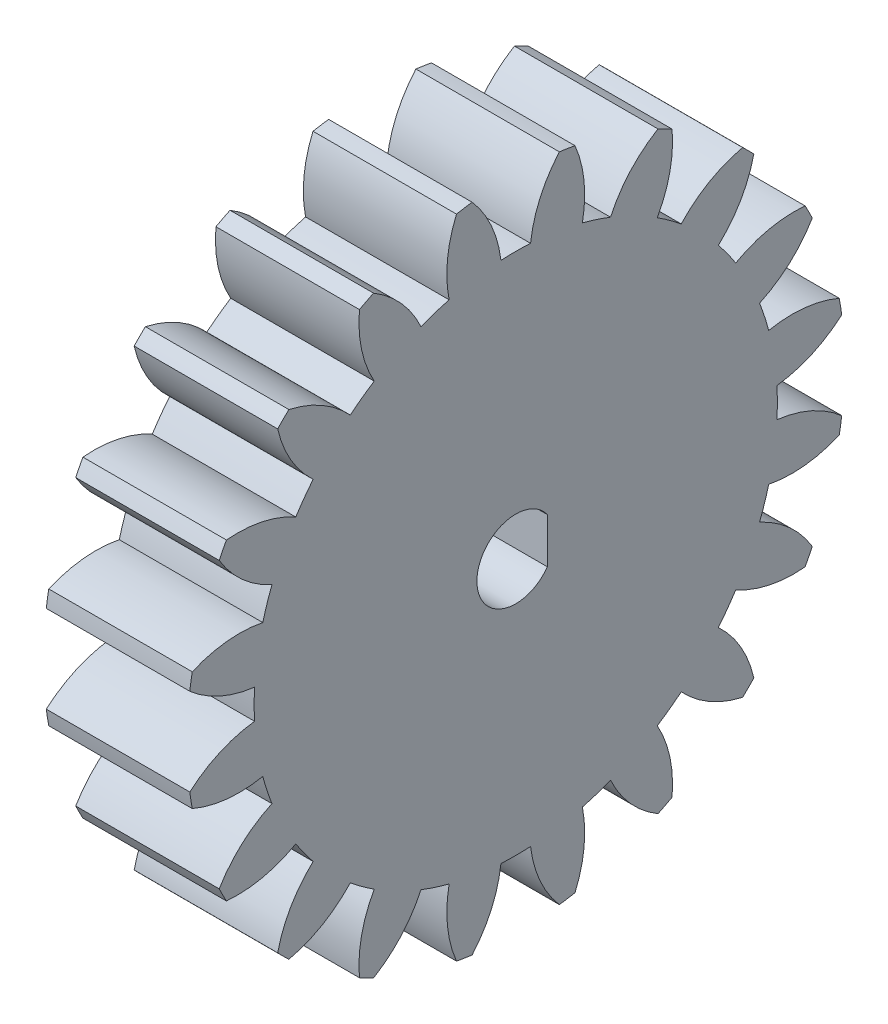
from build123d import *

# Parameters (mm, degrees)
BASPROSKE_W           = 12
BASPROSKE_H           = 27.5
TOOTHCUT_DEPTH        = 41.70012285
TEETHCUTS_COUNT       = 20
TEETHCUTS_ANGLE       = 342
BORSKE_R              = 0.4
BORE_DEPTH            = 50.0000508
KES_EKSTR_ZYON1_DEPTH = 100


with BuildPart() as part:
    # BasProSke → Base-Revolve (revolve)
    with BuildSketch(Plane(origin=(0, 0, 0), x_dir=(1, 0, 0), z_dir=(0, 1, 0)), mode=Mode.PRIVATE) as base_revolve_sk:
        with Locations((6, 13.75)):
            Rectangle(BASPROSKE_W, BASPROSKE_H)
    revolve(base_revolve_sk.sketch.rotate(Axis((-10, 0, 0), (1, 0, 0)), 180), axis=Axis((-10, 0, 0), (1, 0, 0)))

    # TooCutSke → ToothCut (cut, through all)
    with BuildSketch(Plane(origin=(0, 0, 0), x_dir=(0, 0, -1), z_dir=(1, 0, 0))):
        with BuildLine():
            ThreePointArc((1.237725267, 21.838954008), (0, 21.874), (-1.237725267, 21.838954008))
            ThreePointArc((-1.237725267, 21.838954008), (-2.037783758, 24.744650423), (-3.667234079, 27.280011719))
            ThreePointArc((-3.667234079, 27.280011719), (0, 27.5254), (3.667234079, 27.280011719))
            ThreePointArc((3.667234079, 27.280011719), (2.037783758, 24.744650423), (1.237725267, 21.838954008))
        make_face()
    toothcut = extrude(amount=TOOTHCUT_DEPTH, mode=Mode.SUBTRACT)

    # TeethCuts: ToothCut ×20 about axis
    teethcuts_axis = Axis((-10, 0, 0), (1, 0, 0))
    for i in range(1, TEETHCUTS_COUNT):
        add(toothcut.rotate(teethcuts_axis, i * TEETHCUTS_ANGLE / (TEETHCUTS_COUNT - 1)), mode=Mode.SUBTRACT)

    # BorSke → Bore (cut, symmetric)
    with BuildSketch(Plane(origin=(0, 0, 0), x_dir=(0, 0, -1), z_dir=(1, 0, 0))):
        with Locations(Location((0, 0, 0), (0, 0, 180))):
            Circle(BORSKE_R)
    extrude(amount=BORE_DEPTH, both=True, mode=Mode.SUBTRACT)

    # Çizim1 → Kes-Ekstrüzyon1 (cut)
    with BuildSketch(Plane.ZY):
        with BuildLine():
            ThreePointArc((3.25, -0.4), (0.99239773, 2.694777334), (-2.643936459, 1.49))
            Line((-2.643936459, 1.49), (-2.643936459, -2.29))
            ThreePointArc((-2.643936459, -2.29), (0.99239773, -3.494777334), (3.25, -0.4))
        make_face()
    extrude(amount=-KES_EKSTR_ZYON1_DEPTH, mode=Mode.SUBTRACT)


solid = part.part
